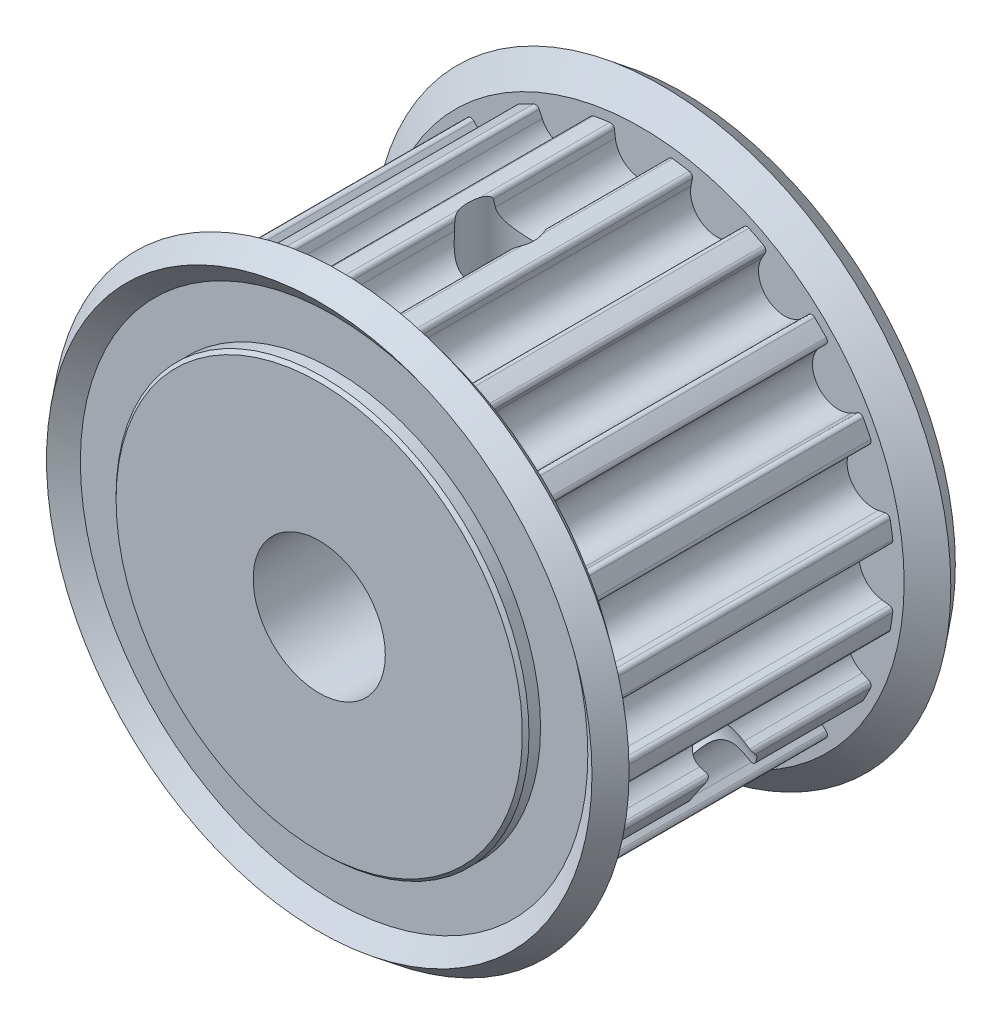
from build123d import *
from build123d.topology import SkipClean

# Parameters (mm, degrees)
CUT_EXTRUDE_START        = 8.5
CUT_EXTRUDE_1_DEPTH      = 17
PATTERN_CIRCULAR_1_COUNT = 20
CUT_EXTRUDE_START_2      = -11
CUT_EXTRUDE_N_DEPTH      = 22
EXTRUDE_START            = -11
EXTRUDE_P_DEPTH          = 22
SKETCH_7_R               = 2
CUT_EXTRUDE_1_2_DEPTH    = 15.345
PATTERN_CIRCULAR_2_COUNT = 2
PATTERN_CIRCULAR_2_ANGLE = 120
CHAMFER_1_SIZE           = 0.2


with BuildPart() as part:
    # 草图3 → 旋转1 (revolve)
    with BuildSketch(Plane(origin=(0, 0, 0), x_dir=(0, 0, -1), z_dir=(1, 0, 0)), mode=Mode.PRIVATE) as revolve_1_sk:
        Polygon((-11, 12.5), (-11, 0), (11, 0), (11, 12.5), (10.1, 12.5), (10.1, 15.363593547), (11, 16.514262338), (9.739713818, 17.5), (8.5, 15.915), (8.5, 15.345), (-8.5, 15.345), (-8.5, 15.915), (-9.739713818, 17.5), (-11, 16.514262338), (-10.1, 15.363593547), (-10.1, 12.5), align=None)
    revolve(revolve_1_sk.sketch.rotate(Axis((0, 0, 34.781081475), (0, 0, -1)), 90), axis=Axis((0, 0, 34.781081475), (0, 0, -1)))

    # 草图4 → Cut-Extrude 1 (cut)
    with BuildSketch(Plane.XY.offset(CUT_EXTRUDE_START)):
        with BuildLine():
            Line((-1.571812751, 14.575622452), (-1.625, 15.008797834))
            ThreePointArc((-1.625, 15.008797834), (-1.719441663, 15.175505257), (-1.904159005, 15.226398244))
            ThreePointArc((-1.904159005, 15.226398244), (0, 15.345), (1.904159005, 15.226398244))
            ThreePointArc((1.904159005, 15.226398244), (1.719441663, 15.175505257), (1.625, 15.008797834))
            Line((1.625, 15.008797834), (1.571812751, 14.575622452))
            ThreePointArc((1.571812751, 14.575622452), (0, 13.185), (-1.571812751, 14.575622452))
        make_face()
    cut_extrude_1 = extrude(amount=-CUT_EXTRUDE_1_DEPTH, mode=Mode.SUBTRACT)

    # 阵列(圆周)1: Cut-Extrude 1 ×20 about axis
    pattern_circular_1_axis = Axis((0, 0, 0), (0, 0, 1))
    for i in range(1, PATTERN_CIRCULAR_1_COUNT):
        add(cut_extrude_1.rotate(pattern_circular_1_axis, i * 360 / PATTERN_CIRCULAR_1_COUNT), mode=Mode.SUBTRACT)

    # 草图6 → N (cut)
    with BuildSketch(Plane.XY.offset(CUT_EXTRUDE_START_2)):
        with BuildLine():
            Line((-1.5, 5.4), (1.5, 5.4))
            Line((1.5, 5.4), (1.5, 3.708099244))
            ThreePointArc((1.5, 3.708099244), (0, -4), (-1.5, 3.708099244))
            Line((-1.5, 3.708099244), (-1.5, 5.4))
        make_face()
    extrude(amount=CUT_EXTRUDE_N_DEPTH, mode=Mode.SUBTRACT)

    # 草图8 → P (add)
    with SkipClean():  # the faces are left unmerged after this step: merging them gives an invalid solid
        with BuildSketch(Plane.XY.offset(EXTRUDE_START)):
            with BuildLine():
                Line((-1.5, 3.708099244), (-1.5, 5.4))
                Line((-1.5, 5.4), (1.5, 5.4))
                Line((1.5, 5.4), (1.5, 3.708099244))
                ThreePointArc((1.5, 3.708099244), (0, 4), (-1.5, 3.708099244))
            make_face()
        extrude(amount=EXTRUDE_P_DEPTH)

    # 草图7 → Cut-Extrude 1 2 (cut)
    with SkipClean():  # the faces are left unmerged after this step: merging them gives an invalid solid
        with BuildSketch(Plane(origin=(0, 0, 0), x_dir=(1, 0, 0), z_dir=(0, 1, 0))):
            with Locations(Location((0, 0, 0), (0, 0, 90))):
                Circle(SKETCH_7_R)
        cut_extrude_1_2 = extrude(amount=CUT_EXTRUDE_1_2_DEPTH, mode=Mode.SUBTRACT)

    # 螺纹孔2: Cut-Extrude 1 2 ×2 about axis
    with SkipClean():  # the faces are left unmerged after this step: merging them gives an invalid solid
        pattern_circular_2_axis = Axis((0, 0, 34.781081475), (0, 0, -1))
        for i in range(1, PATTERN_CIRCULAR_2_COUNT):
            add(cut_extrude_1_2.rotate(pattern_circular_2_axis, i * PATTERN_CIRCULAR_2_ANGLE / (PATTERN_CIRCULAR_2_COUNT - 1)), mode=Mode.SUBTRACT)

    # 倒角1
    chamfer_1_edges = [part.edges().sort_by_distance(p)[0] for p in [
        (-12.5, 0, -11),
        (-12.5, 0, 11),
    ]]
    chamfer(chamfer_1_edges, length=CHAMFER_1_SIZE)


solid = part.part
